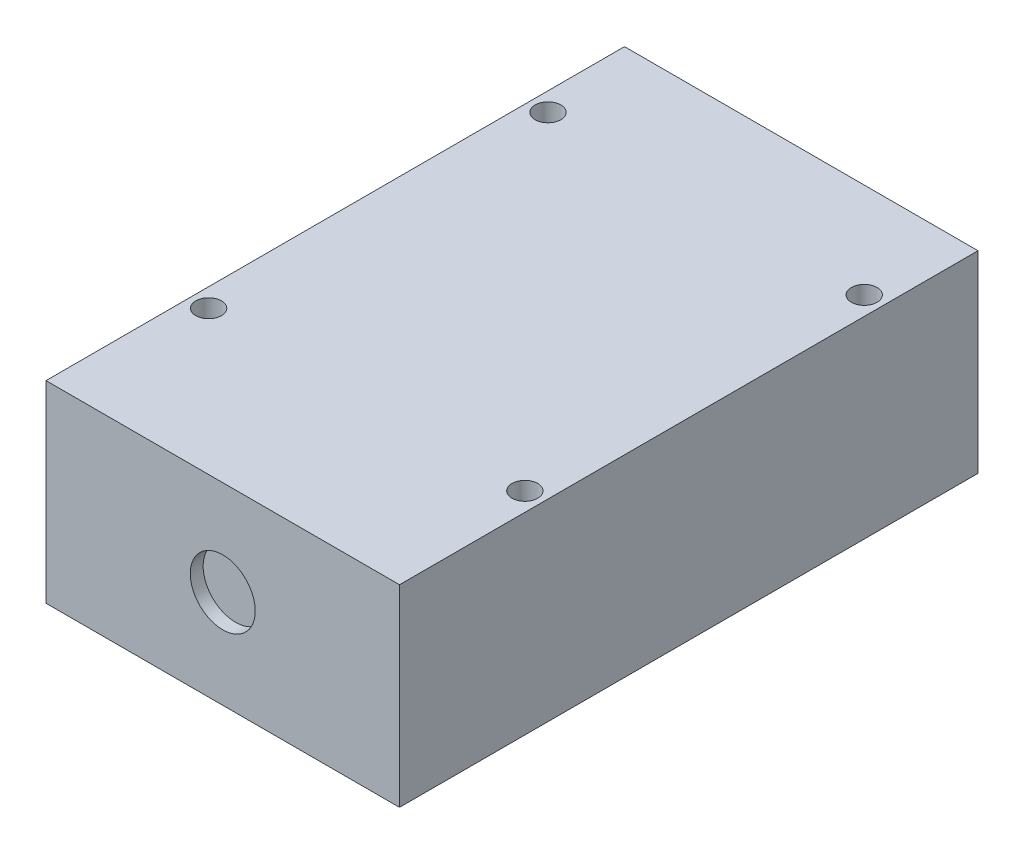
from build123d import *

# Parameters (mm, degrees)
SKETCH_1_W          = 27.5
SKETCH_1_H          = 45
SKETCH_1_R          = 1
EXTRUDE_1_DEPTH     = 15
SKETCH_2_R          = 2.526456565
CUT_EXTRUDE_1_DEPTH = 1


with BuildPart() as part:
    # 草图1 → 凸台-拉伸1 (new body)
    with BuildSketch(Plane(origin=(0, 0, 0), x_dir=(1, 0, 0), z_dir=(0, 1, 0))):
        Rectangle(SKETCH_1_W, SKETCH_1_H)
        with Locations(Location((-12.3, 15.1, 0), (0, 0, 270))):
            Circle(SKETCH_1_R, mode=Mode.SUBTRACT)
        with Locations(Location((12.3, 15.1, 0), (0, 0, 270))):
            Circle(SKETCH_1_R, mode=Mode.SUBTRACT)
        with Locations(Location((12.3, -11.3, 0), (0, 0, 270))):
            Circle(SKETCH_1_R, mode=Mode.SUBTRACT)
        with Locations(Location((-12.3, -11.3, 0), (0, 0, 270))):
            Circle(SKETCH_1_R, mode=Mode.SUBTRACT)
    extrude(amount=EXTRUDE_1_DEPTH)

    # 草图2 → 切除-拉伸1 (cut)
    with BuildSketch(Plane.XY.offset(22.5)):
        with Locations((0, 7.614868715)):
            Circle(SKETCH_2_R)
    extrude(amount=-CUT_EXTRUDE_1_DEPTH, mode=Mode.SUBTRACT)


solid = part.part
